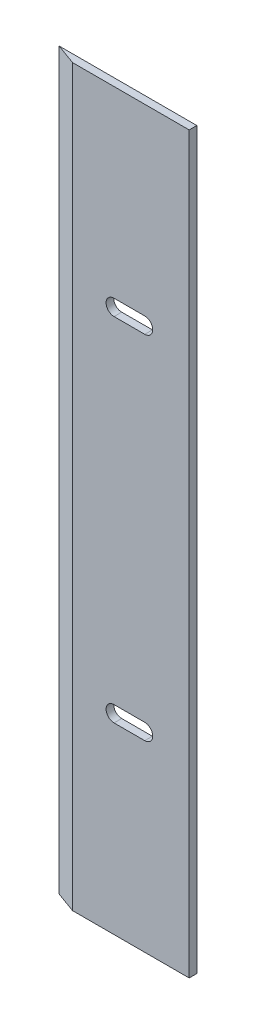
from build123d import *

# Parameters (mm, degrees)
SKETCH_1_W          = 18
SKETCH_1_H          = 96
EXTRUDE_1_DEPTH     = 1
CUT_EXTRUDE_1_DEPTH = 117.756631965


with BuildPart() as part:
    # Эскиз1 → Бобышка-Вытянуть1 (new body)
    with BuildSketch(Plane.XY):
        with Locations((-57.446302439, 0)):
            Rectangle(SKETCH_1_W, SKETCH_1_H)
        with BuildLine():
            Line((-54.254431019, 21.962877229), (-58.271972276, 21.962877229))
            ThreePointArc((-58.271972276, 21.962877229), (-59.309095047, 23), (-58.271972276, 24.037122771))
            Line((-58.271972276, 24.037122771), (-54.254431019, 24.037122771))
            ThreePointArc((-54.254431019, 24.037122771), (-53.217308248, 23), (-54.254431019, 21.962877229))
        make_face(mode=Mode.SUBTRACT)
        with BuildLine():
            Line((-54.254431019, -21.962877229), (-58.271972276, -21.962877229))
            ThreePointArc((-58.271972276, -21.962877229), (-59.309095047, -23), (-58.271972276, -24.037122771))
            Line((-58.271972276, -24.037122771), (-54.254431019, -24.037122771))
            ThreePointArc((-54.254431019, -24.037122771), (-53.217308248, -23), (-54.254431019, -21.962877229))
        make_face(mode=Mode.SUBTRACT)
    extrude(amount=EXTRUDE_1_DEPTH)

    # Эскиз2 → Вырез-Вытянуть1 (cut, through all)
    with BuildSketch(Plane(origin=(0, 48, 0), x_dir=(1, 0, 0), z_dir=(0, 1, 0))):
        Polygon((-66.446302439, 0), (-63.698825019, -1), (-66.446302439, -1), align=None)
    extrude(amount=-CUT_EXTRUDE_1_DEPTH, mode=Mode.SUBTRACT)


solid = part.part
